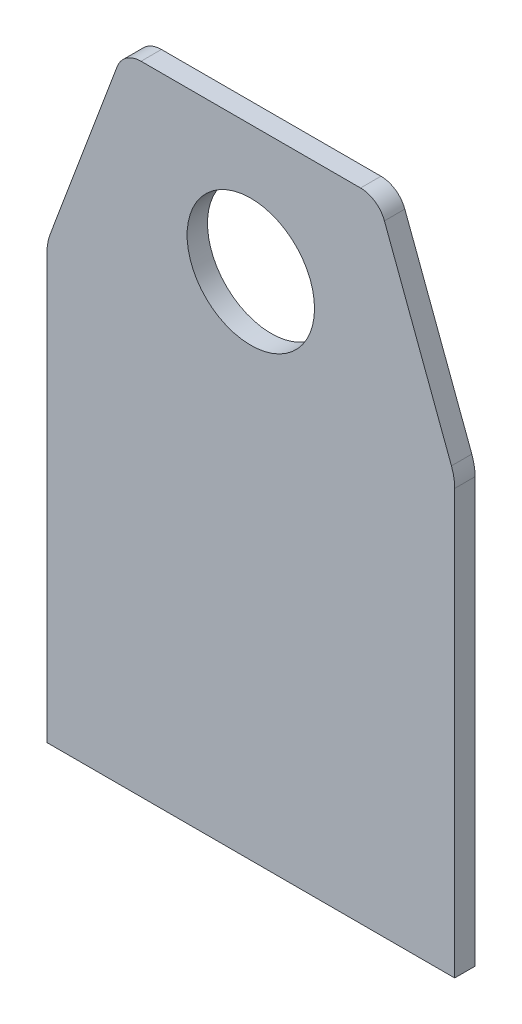
from build123d import *

# Parameters (mm, degrees)
BOSS_EXTRUDE1_DEPTH = 8
SKETCH4_R           = 25
CUT_EXTRUDE1_DEPTH  = 8
FILLET2_R           = 20
FILLET4_R           = 20
FILLET5_R           = 10


with BuildPart() as part:
    # Sketch2 → Boss-Extrude1 (new body)
    with BuildSketch(Plane.XY):
        Polygon((-80, 0), (-80, 170), (-50, 250), (50, 250), (80, 170), (80, 0), align=None)
    extrude(amount=BOSS_EXTRUDE1_DEPTH)

    # Sketch4 → Cut-Extrude1 (cut)
    with BuildSketch(Plane.XY.offset(8)):
        with Locations((0, 200)):
            Circle(SKETCH4_R)
    extrude(amount=-CUT_EXTRUDE1_DEPTH, mode=Mode.SUBTRACT)

    # Fillet2
    fillet2_edges = [part.edges().sort_by_distance(p)[0] for p in [
        (-80, 170, 4),
    ]]
    fillet(fillet2_edges, radius=FILLET2_R)

    # Fillet4
    fillet4_edges = [part.edges().sort_by_distance(p)[0] for p in [
        (80, 170, 4),
    ]]
    fillet(fillet4_edges, radius=FILLET4_R)

    # Fillet5
    fillet5_edges = [part.edges().sort_by_distance(p)[0] for p in [
        (-50, 250, 4),
        (50, 250, 4),
    ]]
    fillet(fillet5_edges, radius=FILLET5_R)


solid = part.part
